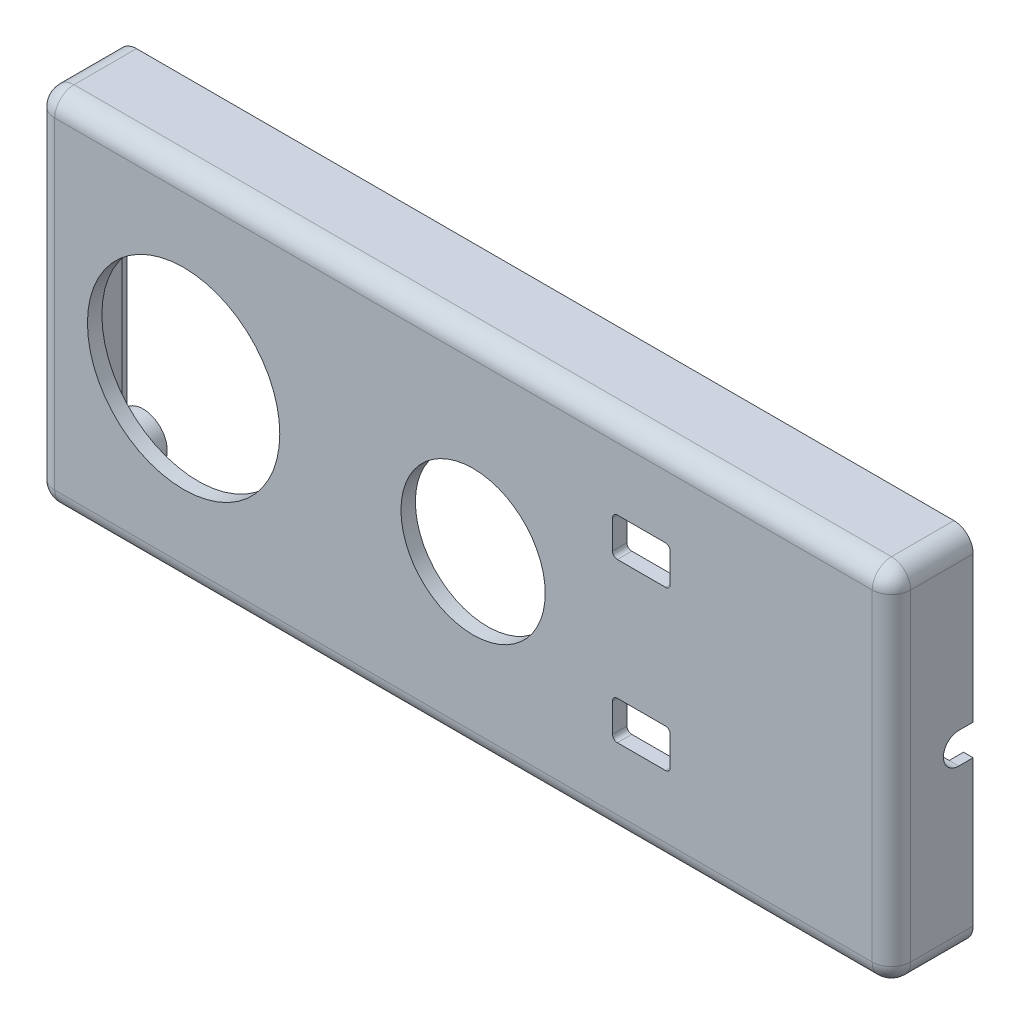
from build123d import *

# Parameters (mm, degrees)
SKETCH_1_W           = 89
SKETCH_1_H           = 37.5
EXTRUDE_1_DEPTH      = 8.5
SKETCH_2_W           = 85
SKETCH_2_H           = 33.5
CUT_EXTRUDE_1_DEPTH  = 7
CUT_EXTRUDE_3_DEPTH  = 4
FILLET_1_R           = 2
EXTRUDE_2_DEPTH      = 1
SKETCH_10_R          = 2.5
EXTRUDE_3_DEPTH      = 4.5
SKETCH_11_R          = 0.79
CUT_EXTRUDE_9_DEPTH  = 3
SKETCH_8_R           = 7.5
CUT_EXTRUDE_8_DEPTH  = 3
SKETCH_7_R           = 10
CUT_EXTRUDE_7_DEPTH  = 3
CUT_EXTRUDE_START    = -2.5
CUT_EXTRUDE_10_DEPTH = 2.5
CUT_EXTRUDE_11_DEPTH = 10


with BuildPart() as part:
    # 草图1 → 凸台-拉伸1 (new body)
    with BuildSketch(Plane.XY):
        Rectangle(SKETCH_1_W, SKETCH_1_H)
    extrude(amount=EXTRUDE_1_DEPTH)

    # 草图2 → 切除-拉伸1 (cut)
    with BuildSketch(Plane(origin=(0, 0, 0), x_dir=(-1, 0, 0), z_dir=(0, 0, -1))):
        Rectangle(SKETCH_2_W, SKETCH_2_H)
    extrude(amount=-CUT_EXTRUDE_1_DEPTH, mode=Mode.SUBTRACT)

    # 草图3 → 切除-拉伸3 (cut)
    with BuildSketch(Plane(origin=(44.5, 0, 0), x_dir=(0, 0, -1), z_dir=(1, 0, 0))):
        with BuildLine():
            Line((0, 1.6), (0, -1.6))
            Line((0, -1.6), (-1.5, -1.6))
            ThreePointArc((-1.5, -1.6), (-3.1, 0), (-1.5, 1.6))
            Line((-1.5, 1.6), (0, 1.6))
        make_face()
    extrude(amount=-CUT_EXTRUDE_3_DEPTH, mode=Mode.SUBTRACT)

    # 圆角1
    fillet_1_edges = [part.edges().sort_by_distance(p)[0] for p in [
        (-44.5, 0, 8.5),
        (0, -18.75, 8.5),
        (42.5, -16.75, 3.5),
        (42.5, 16.75, 3.5),
        (-42.5, 16.75, 3.5),
        (-42.5, -16.75, 3.5),
        (44.5, 0, 8.5),
        (0, 18.75, 8.5),
        (44.5, -18.75, 4.25),
        (-44.5, -18.75, 4.25),
        (-44.5, 18.75, 4.25),
        (44.5, 18.75, 4.25),
    ]]
    fillet(fillet_1_edges, radius=FILLET_1_R)

    # 草图9 → 凸台-拉伸2 (add)
    with BuildSketch(Plane(origin=(0, 0, 0), x_dir=(-1, 0, 0), z_dir=(0, 0, -1))):
        with BuildLine():
            Line((-43.5, 15.75), (-43.5, 1.6))
            Line((-43.5, 1.6), (-42.5, 1.6))
            Line((-42.5, 1.6), (-42.5, 14.75))
            ThreePointArc((-42.5, 14.75), (-41.914213562, 16.164213562), (-40.5, 16.75))
            Line((-40.5, 16.75), (40.5, 16.75))
            ThreePointArc((40.5, 16.75), (41.914213562, 16.164213562), (42.5, 14.75))
            Line((42.5, 14.75), (42.5, -14.75))
            ThreePointArc((42.5, -14.75), (41.914213562, -16.164213562), (40.5, -16.75))
            Line((40.5, -16.75), (-40.5, -16.75))
            ThreePointArc((-40.5, -16.75), (-41.914213562, -16.164213562), (-42.5, -14.75))
            Line((-42.5, -14.75), (-42.5, -1.6))
            Line((-42.5, -1.6), (-43.5, -1.6))
            Line((-43.5, -1.6), (-43.5, -15.75))
            ThreePointArc((-43.5, -15.75), (-42.914213562, -17.164213562), (-41.5, -17.75))
            Line((-41.5, -17.75), (41.5, -17.75))
            ThreePointArc((41.5, -17.75), (42.914213562, -17.164213562), (43.5, -15.75))
            Line((43.5, -15.75), (43.5, 15.75))
            ThreePointArc((43.5, 15.75), (42.914213562, 17.164213562), (41.5, 17.75))
            Line((41.5, 17.75), (-41.5, 17.75))
            ThreePointArc((-41.5, 17.75), (-42.914213562, 17.164213562), (-43.5, 15.75))
        make_face()
    extrude(amount=EXTRUDE_2_DEPTH)

    # 草图10 → 凸台-拉伸3 (add)
    with BuildSketch(Plane(origin=(0, 0, 7), x_dir=(-1, 0, 0), z_dir=(0, 0, -1))):
        with Locations((39.3, -13.35)):
            Circle(SKETCH_10_R)
        with Locations((39.3, 13.35)):
            Circle(SKETCH_10_R)
        with Locations((-34.5, 13.35)):
            Circle(SKETCH_10_R)
        with Locations((-34.5, -13.35)):
            Circle(SKETCH_10_R)
    extrude(amount=EXTRUDE_3_DEPTH)

    # 草图11 → 切除-拉伸9 (cut)
    with BuildSketch(Plane(origin=(0, 0, 2.5), x_dir=(-1, 0, 0), z_dir=(0, 0, -1))):
        with Locations((-34.5, 13.35)):
            Circle(SKETCH_11_R)
        with Locations((-34.5, -13.35)):
            Circle(SKETCH_11_R)
        with Locations((39.3, 13.35)):
            Circle(SKETCH_11_R)
        with Locations((39.3, -13.35)):
            Circle(SKETCH_11_R)
    extrude(amount=-CUT_EXTRUDE_9_DEPTH, mode=Mode.SUBTRACT)

    # 草图8 → 切除-拉伸8 (cut)
    with BuildSketch(Plane(origin=(0, 0, 7), x_dir=(-1, 0, 0), z_dir=(0, 0, -1))):
        with Locations((-1, -0.55)):
            Circle(SKETCH_8_R)
    extrude(amount=-CUT_EXTRUDE_8_DEPTH, mode=Mode.SUBTRACT)

    # 草图7 → 切除-拉伸7 (cut)
    with BuildSketch(Plane(origin=(0, 0, 7), x_dir=(-1, 0, 0), z_dir=(0, 0, -1))):
        with Locations((29.1, 0)):
            Circle(SKETCH_7_R)
    extrude(amount=-CUT_EXTRUDE_7_DEPTH, mode=Mode.SUBTRACT)

    # 草图13 → 切除-拉伸10 (cut)
    with BuildSketch(Plane(origin=(0, 0, -1), x_dir=(-1, 0, 0), z_dir=(0, 0, -1)).offset(CUT_EXTRUDE_START)):
        with BuildLine():
            Line((-41.5, 17.75), (41.5, 17.75))
            ThreePointArc((41.5, 17.75), (42.914213562, 17.164213562), (43.5, 15.75))
            Line((43.5, 15.75), (43.5, -15.75))
            ThreePointArc((43.5, -15.75), (42.914213562, -17.164213562), (41.5, -17.75))
            Line((41.5, -17.75), (-41.5, -17.75))
            ThreePointArc((-41.5, -17.75), (-42.914213562, -17.164213562), (-43.5, -15.75))
            Line((-43.5, -15.75), (-43.5, 15.75))
            ThreePointArc((-43.5, 15.75), (-42.914213562, 17.164213562), (-41.5, 17.75))
        make_face()
    extrude(amount=CUT_EXTRUDE_10_DEPTH, mode=Mode.SUBTRACT)

    # 草图14 → 切除-拉伸11 (cut)
    with BuildSketch(Plane(origin=(0, 0, 7), x_dir=(-1, 0, 0), z_dir=(0, 0, -1))):
        with BuildLine():
            Line((-21, -6.25), (-16, -6.25))
            ThreePointArc((-16, -6.25), (-15.646446609, -6.396446609), (-15.5, -6.75))
            Line((-15.5, -6.75), (-15.5, -9.75))
            ThreePointArc((-15.5, -9.75), (-15.646446609, -10.103553391), (-16, -10.25))
            Line((-16, -10.25), (-21, -10.25))
            ThreePointArc((-21, -10.25), (-21.353553391, -10.103553391), (-21.5, -9.75))
            Line((-21.5, -9.75), (-21.5, -6.75))
            ThreePointArc((-21.5, -6.75), (-21.353553391, -6.396446609), (-21, -6.25))
        make_face()
        with BuildLine():
            Line((-21, 10.25), (-16, 10.25))
            ThreePointArc((-16, 10.25), (-15.646446609, 10.103553391), (-15.5, 9.75))
            Line((-15.5, 9.75), (-15.5, 6.75))
            ThreePointArc((-15.5, 6.75), (-15.646446609, 6.396446609), (-16, 6.25))
            Line((-16, 6.25), (-21, 6.25))
            ThreePointArc((-21, 6.25), (-21.353553391, 6.396446609), (-21.5, 6.75))
            Line((-21.5, 6.75), (-21.5, 9.75))
            ThreePointArc((-21.5, 9.75), (-21.353553391, 10.103553391), (-21, 10.25))
        make_face()
    extrude(amount=-CUT_EXTRUDE_11_DEPTH, mode=Mode.SUBTRACT)


solid = part.part
